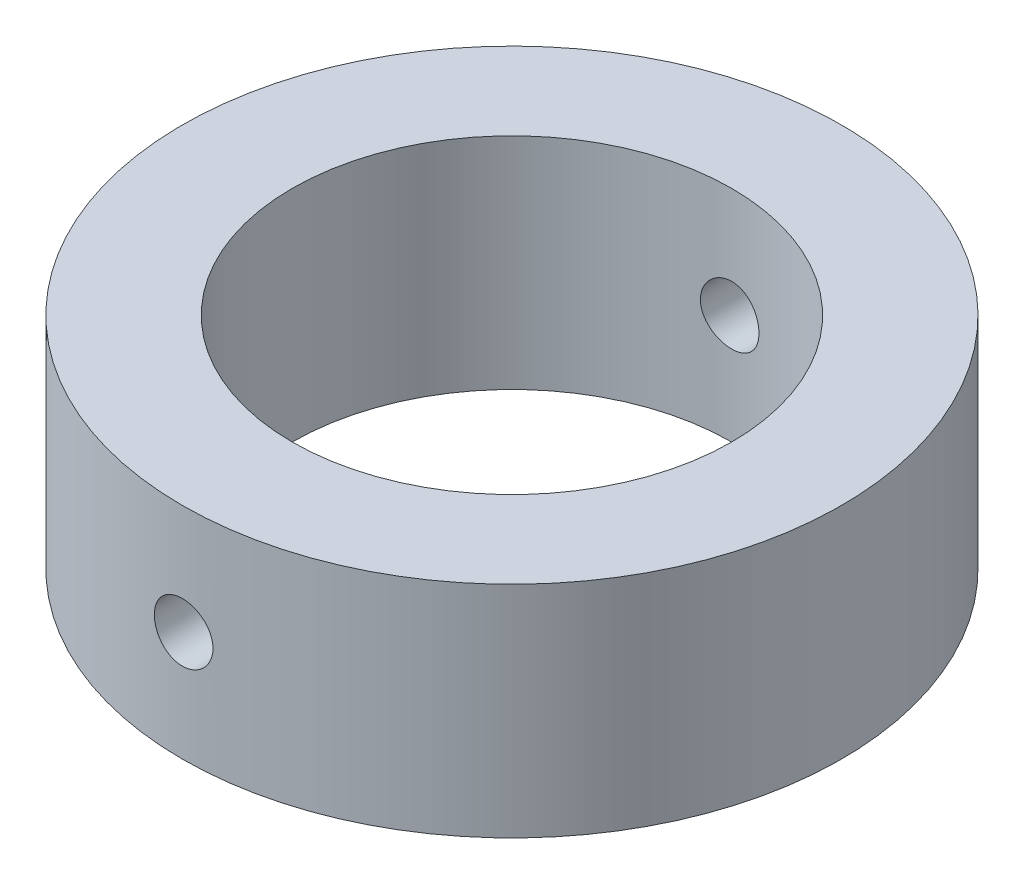
from build123d import *

# Parameters (mm, degrees)
SKETCH1_R               = 22.5
SKETCH1_R_2             = 15
BOSS_EXTRUDE1_DEPTH     = 15
CUT_EXTRUDE1_DEPTH      = 36.178118199
CUT_EXTRUDE1_DEPTH_BACK = 36.178118199
SKETCH2_R               = 2


with BuildPart() as part:
    # Sketch1 → Boss-Extrude1 (new body)
    with BuildSketch(Plane(origin=(0, 0, 0), x_dir=(1, 0, 0), z_dir=(0, 1, 0))):
        with Locations(Location((0, 0, 0), (0, 0, 270))):
            Circle(SKETCH1_R)
        with Locations(Location((0, 0, 0), (0, 0, 270))):
            Circle(SKETCH1_R_2, mode=Mode.SUBTRACT)
    extrude(amount=BOSS_EXTRUDE1_DEPTH)

    # Sketch2 → Cut-Extrude1 (cut, two sides: drawn at the far end of the back side and taken through both)
    with BuildSketch(Plane.XY.offset(-CUT_EXTRUDE1_DEPTH_BACK)):
        with Locations((0, 7.5)):
            Circle(SKETCH2_R)
    extrude(amount=CUT_EXTRUDE1_DEPTH + CUT_EXTRUDE1_DEPTH_BACK, mode=Mode.SUBTRACT)


solid = part.part
